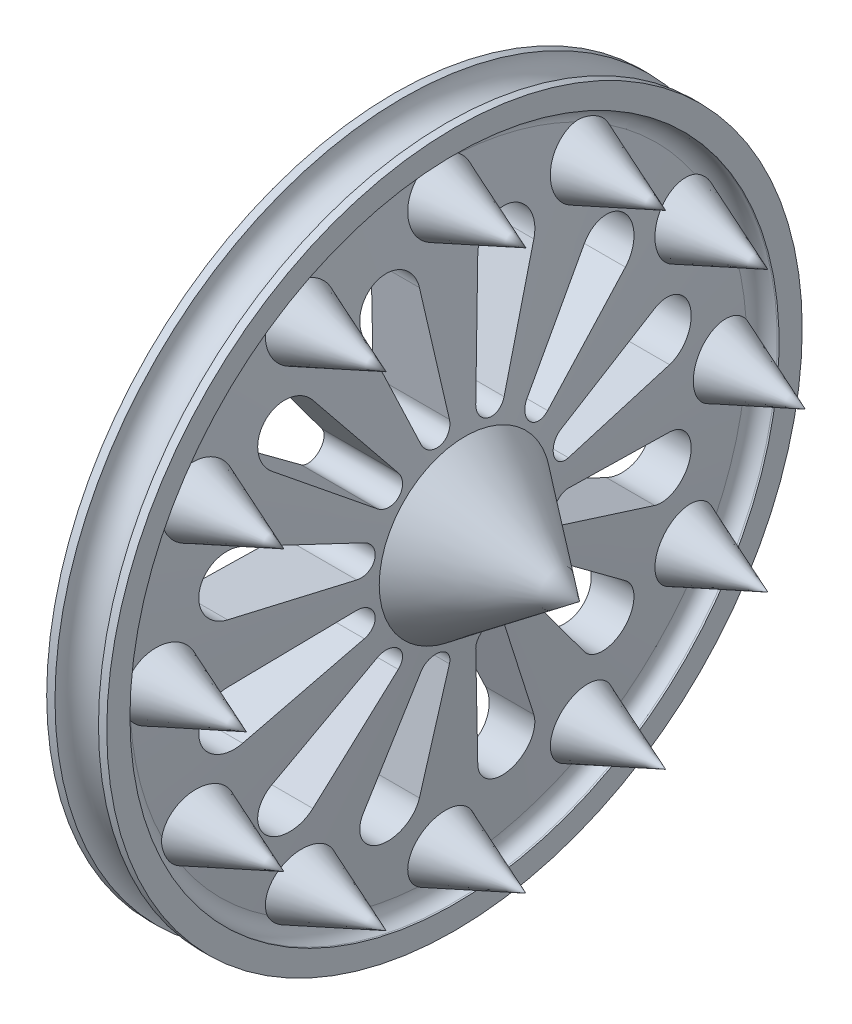
from build123d import *

# Parameters (mm, degrees)
CIRPATTERN1_COUNT  = 12
CUT_EXTRUDE1_DEPTH = 5.08
CUT_EXTRUDE2_DEPTH = 7.62


with BuildPart() as part:
    # Sketch3 → Revolve1 (revolve)
    with BuildSketch(Plane(origin=(0, 0, 0), x_dir=(1, 0, 0), z_dir=(0, 1, 0)), mode=Mode.PRIVATE) as revolve1_sk:
        with BuildLine():
            Line((-3.561149307, 0), (3.561149307, 0))
            Line((3.561149307, 0), (13.595959702, 0))
            Line((13.595959702, 0), (3.561149307, 7.524700579))
            Line((3.561149307, 7.524700579), (1.21652764, 27.026580108))
            ThreePointArc((1.21652764, 27.026580108), (1.527335687, 28.020900914), (2.47744757, 28.448174737))
            Line((2.47744757, 28.448174737), (2.632827972, 28.448174737))
            Line((2.632827972, 28.448174737), (2.632827972, 30.48))
            Line((2.632827972, 30.48), (1.905, 30.48))
            ThreePointArc((1.905, 30.48), (0, 28.575), (-1.905, 30.48))
            Line((-1.905, 30.48), (-2.632827972, 30.48))
            Line((-2.632827972, 30.48), (-2.632827972, 28.448174737))
            Line((-2.632827972, 28.448174737), (-2.47744757, 28.448174737))
            ThreePointArc((-2.47744757, 28.448174737), (-1.527335687, 28.020900914), (-1.21652764, 27.026580108))
            Line((-1.21652764, 27.026580108), (-3.561149307, 7.524700579))
            Line((-3.561149307, 7.524700579), (-3.561149307, 0))
        make_face()
    revolve(revolve1_sk.sketch.rotate(Axis((13.595959702, 0, 0), (1, 0, 0)), 180), axis=Axis((13.595959702, 0, 0), (1, 0, 0)))

    # Sketch4 → Revolve2 (revolve)
    with BuildSketch(Plane(origin=(0, 0, 0), x_dir=(1, 0, 0), z_dir=(0, 1, 0)), mode=Mode.PRIVATE) as revolve2_sk:
        Polygon((0, 28.013958077), (8.89, 24.493603492), (0, 24.493603492), align=None)
    revolve2 = revolve(revolve2_sk.sketch.rotate(Axis((8.89, 0, -24.493603492), (-1, 0, 0)), 180), axis=Axis((8.89, 0, -24.493603492), (-1, 0, 0)))

    # CirPattern1: Revolve2 ×12 about axis
    cirpattern1_axis = Axis((0, 0, 0), (1, 0, 0))
    for i in range(1, CIRPATTERN1_COUNT):
        add(revolve2.rotate(cirpattern1_axis, i * 360 / CIRPATTERN1_COUNT))

    # Sketch7 → Cut-Extrude1 (cut)
    with BuildSketch(Plane.ZY.offset(3.561149307)):
        Polygon((0, 6.995060391), (-6.0579, 3.497530196), (-6.0579, -3.497530196), (0, -6.995060391), (6.0579, -3.497530196), (6.0579, 3.497530196), align=None)
    extrude(amount=-CUT_EXTRUDE1_DEPTH, mode=Mode.SUBTRACT)

    # Sketch8 → Cut-Extrude2 (cut, symmetric)
    with BuildSketch(Plane(origin=(0, 0, 0), x_dir=(0, 0, -1), z_dir=(1, 0, 0))):
        with BuildLine():
            Line((7.457562622, 5.637574005), (15.495067895, 11.898458037))
            ThreePointArc((15.495067895, 11.898458037), (15.732341841, 15.732341841), (11.898458037, 15.495067895))
            Line((11.898458037, 15.495067895), (5.637574005, 7.457562622))
            ThreePointArc((5.637574005, 7.457562622), (5.743646013, 5.743646013), (7.457562622, 5.637574005))
        make_face()
        with BuildLine():
            Line((8.611063615, 3.639651679), (18.051900874, 7.469893412))
            ThreePointArc((18.051900874, 7.469893412), (21.490778615, 5.758436775), (19.36835145, 2.556832979))
            Line((19.36835145, 2.556832979), (9.277225683, 1.153500993))
            ThreePointArc((9.277225683, 1.153500993), (7.845966364, 2.102320351), (8.611063615, 3.639651679))
        make_face()
        with BuildLine():
            Line((9.277225683, -1.153500993), (19.36835145, -2.556832979))
            ThreePointArc((19.36835145, -2.556832979), (21.490778615, -5.758436775), (18.051900874, -7.469893412))
            Line((18.051900874, -7.469893412), (8.611063615, -3.639651679))
            ThreePointArc((8.611063615, -3.639651679), (7.845966364, -2.102320351), (9.277225683, -1.153500993))
        make_face()
        with BuildLine():
            Line((7.457562622, -5.637574005), (15.495067895, -11.898458037))
            ThreePointArc((15.495067895, -11.898458037), (15.732341841, -15.732341841), (11.898458037, -15.495067895))
            Line((11.898458037, -15.495067895), (5.637574005, -7.457562622))
            ThreePointArc((5.637574005, -7.457562622), (5.743646013, -5.743646013), (7.457562622, -5.637574005))
        make_face()
        with BuildLine():
            Line((3.639651679, -8.611063615), (7.469893412, -18.051900874))
            ThreePointArc((7.469893412, -18.051900874), (5.758436775, -21.490778615), (2.556832979, -19.36835145))
            Line((2.556832979, -19.36835145), (1.153500993, -9.277225683))
            ThreePointArc((1.153500993, -9.277225683), (2.102320351, -7.845966364), (3.639651679, -8.611063615))
        make_face()
        with BuildLine():
            Line((-1.153500993, -9.277225683), (-2.556832979, -19.36835145))
            ThreePointArc((-2.556832979, -19.36835145), (-5.758436775, -21.490778615), (-7.469893412, -18.051900874))
            Line((-7.469893412, -18.051900874), (-3.639651679, -8.611063615))
            ThreePointArc((-3.639651679, -8.611063615), (-2.102320351, -7.845966364), (-1.153500993, -9.277225683))
        make_face()
        with BuildLine():
            Line((-5.637574005, -7.457562622), (-11.898458037, -15.495067895))
            ThreePointArc((-11.898458037, -15.495067895), (-15.732341841, -15.732341841), (-15.495067895, -11.898458037))
            Line((-15.495067895, -11.898458037), (-7.457562622, -5.637574005))
            ThreePointArc((-7.457562622, -5.637574005), (-5.743646013, -5.743646013), (-5.637574005, -7.457562622))
        make_face()
        with BuildLine():
            Line((-8.611063615, -3.639651679), (-18.051900874, -7.469893412))
            ThreePointArc((-18.051900874, -7.469893412), (-21.490778615, -5.758436775), (-19.36835145, -2.556832979))
            Line((-19.36835145, -2.556832979), (-9.277225683, -1.153500993))
            ThreePointArc((-9.277225683, -1.153500993), (-7.845966364, -2.102320351), (-8.611063615, -3.639651679))
        make_face()
        with BuildLine():
            Line((-9.277225683, 1.153500993), (-19.36835145, 2.556832979))
            ThreePointArc((-19.36835145, 2.556832979), (-21.490778615, 5.758436775), (-18.051900874, 7.469893412))
            Line((-18.051900874, 7.469893412), (-8.611063615, 3.639651679))
            ThreePointArc((-8.611063615, 3.639651679), (-7.845966364, 2.102320351), (-9.277225683, 1.153500993))
        make_face()
        with BuildLine():
            Line((-7.457562622, 5.637574005), (-15.495067895, 11.898458037))
            ThreePointArc((-15.495067895, 11.898458037), (-15.732341841, 15.732341841), (-11.898458037, 15.495067895))
            Line((-11.898458037, 15.495067895), (-5.637574005, 7.457562622))
            ThreePointArc((-5.637574005, 7.457562622), (-5.743646013, 5.743646013), (-7.457562622, 5.637574005))
        make_face()
        with BuildLine():
            Line((-3.639651679, 8.611063615), (-7.469893412, 18.051900874))
            ThreePointArc((-7.469893412, 18.051900874), (-5.758436775, 21.490778615), (-2.556832979, 19.36835145))
            Line((-2.556832979, 19.36835145), (-1.153500993, 9.277225683))
            ThreePointArc((-1.153500993, 9.277225683), (-2.102320351, 7.845966364), (-3.639651679, 8.611063615))
        make_face()
        with BuildLine():
            Line((1.153500993, 9.277225683), (2.556832979, 19.36835145))
            ThreePointArc((2.556832979, 19.36835145), (5.758436775, 21.490778615), (7.469893412, 18.051900874))
            Line((7.469893412, 18.051900874), (3.639651679, 8.611063615))
            ThreePointArc((3.639651679, 8.611063615), (2.102320351, 7.845966364), (1.153500993, 9.277225683))
        make_face()
    extrude(amount=CUT_EXTRUDE2_DEPTH, both=True, mode=Mode.SUBTRACT)


solid = part.part
